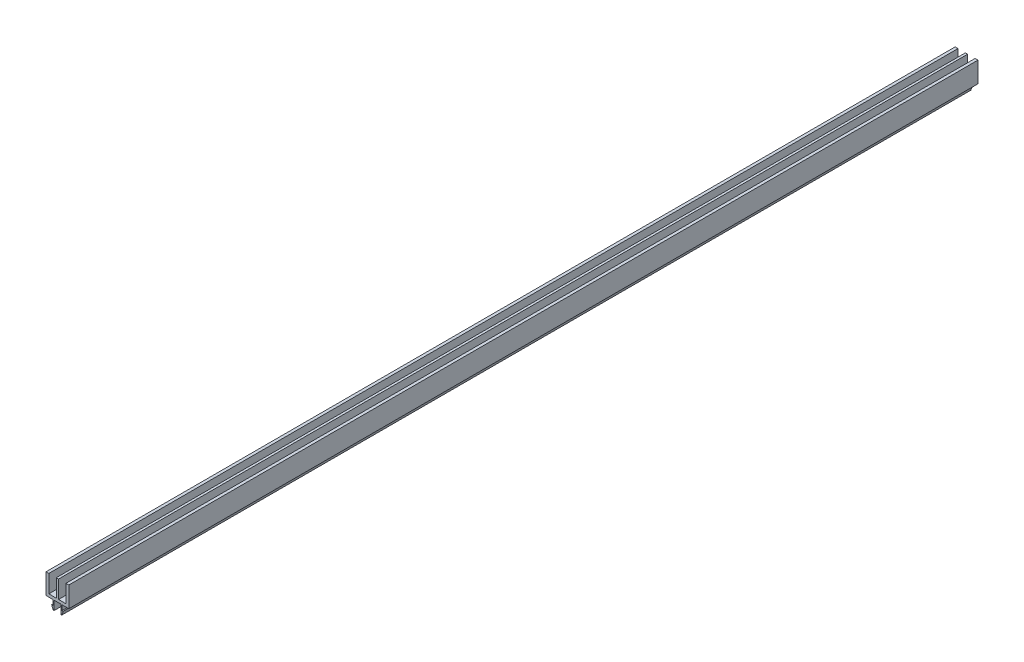
from build123d import *

# Parameters (mm, degrees)
BOSS_EXTRU_1_DEPTH = 796


with BuildPart() as part:
    # Esquisse1 → Boss.-Extru.1 (new body)
    with BuildSketch(Plane.XY.offset(50)):
        Polygon((-1, 2.5), (-7.5, 2.5), (-7.5, 17.999999998), (-10, 17.999999998), (-10, 0), (-4, 0), (-4, -4.5), (-5, -4.5), (-3.75, -8), (-3, -8), (-3, 0), (3, 0), (3, -8), (3.75, -8), (5, -4.5), (4, -4.5), (4, 0), (10, 0), (10, 17.999999998), (7.5, 17.999999998), (7.5, 2.5), (1, 2.5), (1, 17.999999998), (-1, 17.999999998), align=None)
    extrude(amount=-BOSS_EXTRU_1_DEPTH)


solid = part.part
